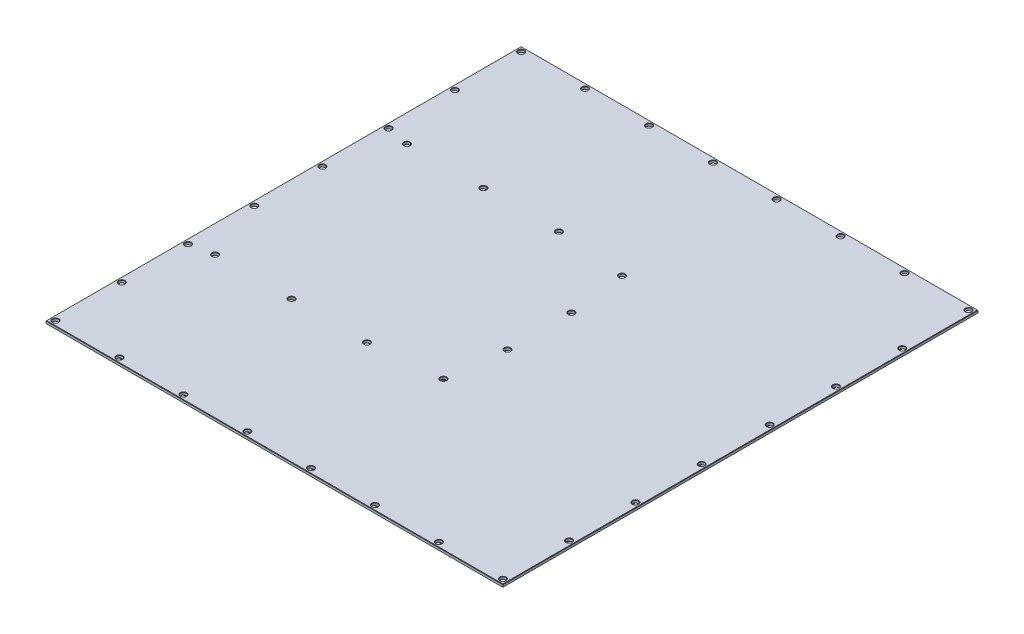
from build123d import *

# Parameters (mm, degrees)
SKETCH1_W          = 317.5
SKETCH1_H          = 330.2
SKETCH1_R          = 1.9812
EXTRUDE4_DEPTH     = 3.175
SKETCH4_R          = 1.9812
NEW_HOLES_DEPTH    = 459.092098409
SKETCH12_W         = 365.029179117
SKETCH12_H         = 387.810687419
CUT_EXTRUDE4_DEPTH = 441.120212015
CUT_EXTRUDE5_DEPTH = 439.693255009
CUT_EXTRUDE5_DRAFT = 15
CUT_EXTRUDE6_DEPTH = 437.337185337
CUT_EXTRUDE6_DRAFT = 15
CUT_EXTRUDE7_DEPTH = 459.084701019
CHAMFER1_SIZE      = 0.254


with BuildPart() as part:
    # Sketch1 → Extrude4 (new body)
    with BuildSketch(Plane(origin=(0, 0, 0), x_dir=(1, 0, 0), z_dir=(0, 1, 0))):
        with Locations((158.75, 165.1)):
            Rectangle(SKETCH1_W, SKETCH1_H)
        with Locations(Location((3.302, 326.898, 0), (0, 0, 270))):
            Circle(SKETCH1_R, mode=Mode.SUBTRACT)
        with Locations(Location((3.302, 141.4526, 0), (0, 0, 90))):
            Circle(SKETCH1_R, mode=Mode.SUBTRACT)
        with Locations(Location((47.752, 326.898, 0), (0, 0, 270))):
            Circle(SKETCH1_R, mode=Mode.SUBTRACT)
        with Locations(Location((92.202, 326.898, 0), (0, 0, 270))):
            Circle(SKETCH1_R, mode=Mode.SUBTRACT)
        with Locations(Location((136.652, 326.898, 0), (0, 0, 270))):
            Circle(SKETCH1_R, mode=Mode.SUBTRACT)
        with Locations(Location((3.302, 280.8478, 0), (0, 0, 270))):
            Circle(SKETCH1_R, mode=Mode.SUBTRACT)
        with Locations(Location((3.302, 234.7976, 0), (0, 0, 270))):
            Circle(SKETCH1_R, mode=Mode.SUBTRACT)
        with Locations(Location((3.302, 188.7474, 0), (0, 0, 270))):
            Circle(SKETCH1_R, mode=Mode.SUBTRACT)
        with Locations(Location((3.302, 95.4024, 0), (0, 0, 90))):
            Circle(SKETCH1_R, mode=Mode.SUBTRACT)
        with Locations(Location((3.302, 49.3522, 0), (0, 0, 90))):
            Circle(SKETCH1_R, mode=Mode.SUBTRACT)
        with Locations(Location((136.652, 3.302, 0), (0, 0, 90))):
            Circle(SKETCH1_R, mode=Mode.SUBTRACT)
        with Locations(Location((92.202, 3.302, 0), (0, 0, 90))):
            Circle(SKETCH1_R, mode=Mode.SUBTRACT)
        with Locations(Location((47.752, 3.302, 0), (0, 0, 90))):
            Circle(SKETCH1_R, mode=Mode.SUBTRACT)
        with Locations(Location((3.302, 3.302, 0), (0, 0, 90))):
            Circle(SKETCH1_R, mode=Mode.SUBTRACT)
        with Locations(Location((314.198, 3.302, 0), (0, 0, 270))):
            Circle(SKETCH1_R, mode=Mode.SUBTRACT)
        with Locations(Location((269.748, 3.302, 0), (0, 0, 270))):
            Circle(SKETCH1_R, mode=Mode.SUBTRACT)
        with Locations(Location((225.298, 3.302, 0), (0, 0, 270))):
            Circle(SKETCH1_R, mode=Mode.SUBTRACT)
        with Locations(Location((180.848, 3.302, 0), (0, 0, 270))):
            Circle(SKETCH1_R, mode=Mode.SUBTRACT)
        with Locations(Location((314.198, 49.3522, 0), (0, 0, 270))):
            Circle(SKETCH1_R, mode=Mode.SUBTRACT)
        with Locations(Location((314.198, 95.4024, 0), (0, 0, 270))):
            Circle(SKETCH1_R, mode=Mode.SUBTRACT)
        with Locations(Location((314.198, 188.7474, 0), (0, 0, 90))):
            Circle(SKETCH1_R, mode=Mode.SUBTRACT)
        with Locations(Location((314.198, 234.7976, 0), (0, 0, 90))):
            Circle(SKETCH1_R, mode=Mode.SUBTRACT)
        with Locations(Location((314.198, 280.8478, 0), (0, 0, 90))):
            Circle(SKETCH1_R, mode=Mode.SUBTRACT)
        with Locations(Location((180.848, 326.898, 0), (0, 0, 90))):
            Circle(SKETCH1_R, mode=Mode.SUBTRACT)
        with Locations(Location((225.298, 326.898, 0), (0, 0, 90))):
            Circle(SKETCH1_R, mode=Mode.SUBTRACT)
        with Locations(Location((269.748, 326.898, 0), (0, 0, 90))):
            Circle(SKETCH1_R, mode=Mode.SUBTRACT)
        with Locations(Location((314.198, 141.4526, 0), (0, 0, 270))):
            Circle(SKETCH1_R, mode=Mode.SUBTRACT)
        with Locations(Location((314.198, 326.898, 0), (0, 0, 90))):
            Circle(SKETCH1_R, mode=Mode.SUBTRACT)
        with Locations(Location((19.05, 231.775, 0), (0, 0, 270))):
            Circle(SKETCH1_R, mode=Mode.SUBTRACT)
        with Locations(Location((72.2122, 231.775, 0), (0, 0, 270))):
            Circle(SKETCH1_R, mode=Mode.SUBTRACT)
        with Locations(Location((124.6378, 231.775, 0), (0, 0, 270))):
            Circle(SKETCH1_R, mode=Mode.SUBTRACT)
        with Locations(Location((124.6378, 98.425, 0), (0, 0, 90))):
            Circle(SKETCH1_R, mode=Mode.SUBTRACT)
        with Locations(Location((72.2122, 98.425, 0), (0, 0, 90))):
            Circle(SKETCH1_R, mode=Mode.SUBTRACT)
        with Locations(Location((19.05, 98.425, 0), (0, 0, 90))):
            Circle(SKETCH1_R, mode=Mode.SUBTRACT)
        with Locations(Location((177.8, 187.325, 0), (0, 0, 270))):
            Circle(SKETCH1_R, mode=Mode.SUBTRACT)
        with Locations(Location((177.8, 142.875, 0), (0, 0, 90))):
            Circle(SKETCH1_R, mode=Mode.SUBTRACT)
    extrude(amount=EXTRUDE4_DEPTH)

    # Sketch4 → new holes (cut, through all)
    with BuildSketch(Plane.XZ):
        with Locations(Location((173.150320151, -227.125320151, 0), (0, 0, 270))):
            Circle(SKETCH4_R)
        with Locations(Location((173.150320151, -103.074679849, 0), (0, 0, 270))):
            Circle(SKETCH4_R)
    extrude(amount=-NEW_HOLES_DEPTH, mode=Mode.SUBTRACT)

    # Sketch12 → Cut-Extrude4 (cut, through all)
    with BuildSketch(Plane(origin=(3.089378177, 1.397, -22.225), x_dir=(1, 0, 0), z_dir=(0, -1, 0))):
        with Locations((152.779774702, -139.492814523)):
            Rectangle(SKETCH12_W, SKETCH12_H)
        with BuildLine():
            Line((2.617480918, 0), (2.617480918, -285.75))
            ThreePointArc((2.617480918, -285.75), (7.455532376, -297.430089447), (19.135621823, -302.268140905))
            Line((19.135621823, -302.268140905), (292.175461823, -302.268140905))
            ThreePointArc((292.175461823, -302.268140905), (303.855551269, -297.430089447), (308.693602728, -285.75))
            Line((308.693602728, -285.75), (308.693602728, 0))
            ThreePointArc((308.693602728, 0), (303.855551269, 11.680089447), (292.175461823, 16.518140905))
            Line((292.175461823, 16.518140905), (19.135621823, 16.518140905))
            ThreePointArc((19.135621823, 16.518140905), (7.455532376, 11.680089447), (2.617480918, 0))
        make_face(mode=Mode.SUBTRACT)
    extrude(amount=CUT_EXTRUDE4_DEPTH, mode=Mode.SUBTRACT)


with BuildPart() as cut_extrude5_tool:
    # Sketch14 → Cut-Extrude5 (with draft: the straight prism first)
    with BuildSketch(Plane(origin=(5.090745431, 1.27, -22.225), x_dir=(-1, 0, 0), z_dir=(0, 1, 0))):
        with BuildLine():
            Line((0.5715, -285.75), (0.5715, 0))
            ThreePointArc((0.5715, 0), (-4.614395447, 12.519859122), (-17.134254569, 17.705754569))
            Line((-17.134254569, 17.705754569), (-290.174094569, 17.705754569))
            ThreePointArc((-290.174094569, 17.705754569), (-302.693953691, 12.519859122), (-307.879849139, 0))
            Line((-307.879849139, 0), (-307.879849139, -285.75))
            ThreePointArc((-307.879849139, -285.75), (-302.693953691, -298.269859122), (-290.174094569, -303.455754569))
            Line((-290.174094569, -303.455754569), (-17.134254569, -303.455754569))
            ThreePointArc((-17.134254569, -303.455754569), (-4.614395447, -298.269859122), (0.5715, -285.75))
        make_face()
        with BuildLine():
            Line((-0.5715, -285.75), (-0.5715, 0))
            ThreePointArc((-0.5715, 0), (-5.422618498, 11.711636071), (-17.134254569, 16.562754569))
            Line((-17.134254569, 16.562754569), (-290.174094569, 16.562754569))
            ThreePointArc((-290.174094569, 16.562754569), (-301.88573064, 11.711636071), (-306.736849139, 0))
            Line((-306.736849139, 0), (-306.736849139, -285.75))
            ThreePointArc((-306.736849139, -285.75), (-301.88573064, -297.461636071), (-290.174094569, -302.312754569))
            Line((-290.174094569, -302.312754569), (-17.134254569, -302.312754569))
            ThreePointArc((-17.134254569, -302.312754569), (-5.422618498, -297.461636071), (-0.5715, -285.75))
        make_face(mode=Mode.SUBTRACT)
    extrude(amount=-CUT_EXTRUDE5_DEPTH)
    # Cut-Extrude5: the draft: its side faces are tilted about the plane it starts from
    cut_extrude5_sides = [cut_extrude5_tool.faces().sort_by_distance(p)[0] for p in [
        (4.519245431, -218.576627505, -165.1),
        (9.705140878, -218.576627505, -9.705140878),
        (158.74492, -218.576627505, -4.519245431),
        (307.784699122, -218.576627505, -9.705140878),
        (312.970594569, -218.576627505, -165.1),
        (307.784699122, -218.576627505, -320.494859122),
        (158.74492, -218.576627505, -325.680754569),
        (9.705140878, -218.576627505, -320.494859122),
        (10.513363929, -218.576627505, -319.686636071),
        (158.74492, -218.576627505, -324.537754569),
        (306.976476071, -218.576627505, -319.686636071),
        (311.827594569, -218.576627505, -165.1),
        (306.976476071, -218.576627505, -10.513363929),
        (158.74492, -218.576627505, -5.662245431),
        (10.513363929, -218.576627505, -10.513363929),
        (5.662245431, -218.576627505, -165.1),
    ]]
    draft(cut_extrude5_sides, Plane(origin=(5.090745431, 1.27, -22.225), x_dir=(-1, 0, 0), z_dir=(0, 1, 0)), CUT_EXTRUDE5_DRAFT)


with BuildPart() as part_1:
    add(part.part)

    # Cut-Extrude5: cut by cut_extrude5_tool
    add(cut_extrude5_tool.part, mode=Mode.SUBTRACT)


with BuildPart() as cut_extrude6_tool:
    # Sketch15 → Cut-Extrude6 (with draft: the straight prism first)
    with BuildSketch(Plane(origin=(8.4074, 1.357499539, -22.225), x_dir=(-1, 0, 0), z_dir=(0, 1, 0))):
        with BuildLine():
            Line((0.635, -285.75), (0.635, 0))
            ThreePointArc((0.635, 0), (-3.598068534, 10.219531466), (-13.8176, 14.4526))
            Line((-13.8176, 14.4526), (-286.85744, 14.4526))
            ThreePointArc((-286.85744, 14.4526), (-297.076971466, 10.219531466), (-301.31004, 0))
            Line((-301.31004, 0), (-301.31004, -285.75))
            ThreePointArc((-301.31004, -285.75), (-297.076971466, -295.969531466), (-286.85744, -300.2026))
            Line((-286.85744, -300.2026), (-13.8176, -300.2026))
            ThreePointArc((-13.8176, -300.2026), (-3.598068534, -295.969531466), (0.635, -285.75))
        make_face()
        with BuildLine():
            Line((-13.8176, -78.88986), (-153.5176, -78.88986))
            ThreePointArc((-153.5176, -78.88986), (-162.840901905, -82.751698095), (-166.70274, -92.075))
            Line((-166.70274, -92.075), (-166.70274, -193.675))
            ThreePointArc((-166.70274, -193.675), (-162.840901905, -202.998301905), (-153.5176, -206.86014))
            Line((-153.5176, -206.86014), (-13.8176, -206.86014))
            ThreePointArc((-13.8176, -206.86014), (-4.494298095, -202.998301905), (-0.63246, -193.675))
            Line((-0.63246, -193.675), (-0.63246, -92.075))
            ThreePointArc((-0.63246, -92.075), (-4.494298095, -82.751698095), (-13.8176, -78.88986))
        make_face(mode=Mode.SUBTRACT)
        with BuildLine():
            Line((-13.8176, -212.23986), (-153.5176, -212.23986))
            ThreePointArc((-153.5176, -212.23986), (-166.644938398, -206.802338398), (-172.08246, -193.675))
            Line((-172.08246, -193.675), (-172.08246, -92.075))
            ThreePointArc((-172.08246, -92.075), (-166.644938398, -78.947661602), (-153.5176, -73.51014))
            Line((-153.5176, -73.51014), (-13.8176, -73.51014))
            ThreePointArc((-13.8176, -73.51014), (-4.494298095, -69.648301905), (-0.63246, -60.325))
            Line((-0.63246, -60.325), (-0.63246, 0))
            ThreePointArc((-0.63246, 0), (-4.494298095, 9.323301905), (-13.8176, 13.18514))
            Line((-13.8176, 13.18514), (-286.85744, 13.18514))
            ThreePointArc((-286.85744, 13.18514), (-296.180741905, 9.323301905), (-300.04258, 0))
            Line((-300.04258, 0), (-300.04258, -285.75))
            ThreePointArc((-300.04258, -285.75), (-296.180741905, -295.073301905), (-286.85744, -298.93514))
            Line((-286.85744, -298.93514), (-13.8176, -298.93514))
            ThreePointArc((-13.8176, -298.93514), (-4.494298095, -295.073301905), (-0.63246, -285.75))
            Line((-0.63246, -285.75), (-0.63246, -225.425))
            ThreePointArc((-0.63246, -225.425), (-4.494298095, -216.101698095), (-13.8176, -212.23986))
        make_face(mode=Mode.SUBTRACT)
    extrude(amount=-CUT_EXTRUDE6_DEPTH)
    # Cut-Extrude6: the draft: its side faces are tilted about the plane it starts from
    cut_extrude6_sides = [cut_extrude6_tool.faces().sort_by_distance(p)[0] for p in [
        (7.7724, -217.31109313, -165.1),
        (12.005468534, -217.31109313, -12.005468534),
        (158.74492, -217.31109313, -7.7724),
        (305.484371466, -217.31109313, -12.005468534),
        (309.71744, -217.31109313, -165.1),
        (305.484371466, -217.31109313, -318.194531466),
        (158.74492, -217.31109313, -322.4276),
        (12.005468534, -217.31109313, -318.194531466),
        (12.901698095, -217.31109313, -225.223301905),
        (92.075, -217.31109313, -229.08514),
        (171.248301905, -217.31109313, -225.223301905),
        (175.11014, -217.31109313, -165.1),
        (171.248301905, -217.31109313, -104.976698095),
        (92.075, -217.31109313, -101.11486),
        (12.901698095, -217.31109313, -104.976698095),
        (9.03986, -217.31109313, -165.1),
        (158.74492, -217.31109313, -9.03986),
        (12.901698095, -217.31109313, -12.901698095),
        (9.03986, -217.31109313, -52.3875),
        (12.901698095, -217.31109313, -91.873301905),
        (92.075, -217.31109313, -95.73514),
        (175.052338398, -217.31109313, -101.172661602),
        (180.48986, -217.31109313, -165.1),
        (175.052338398, -217.31109313, -229.027338398),
        (92.075, -217.31109313, -234.46486),
        (12.901698095, -217.31109313, -238.326698095),
        (9.03986, -217.31109313, -277.8125),
        (12.901698095, -217.31109313, -317.298301905),
        (158.74492, -217.31109313, -321.16014),
        (304.588141905, -217.31109313, -317.298301905),
        (308.44998, -217.31109313, -165.1),
        (304.588141905, -217.31109313, -12.901698095),
    ]]
    draft(cut_extrude6_sides, Plane(origin=(8.4074, 1.357499539, -22.225), x_dir=(-1, 0, 0), z_dir=(0, 1, 0)), CUT_EXTRUDE6_DRAFT)


with BuildPart() as part_2:
    add(part_1.part)

    # Cut-Extrude6: cut by cut_extrude6_tool
    add(cut_extrude6_tool.part, mode=Mode.SUBTRACT)

    # Sketch18 → Cut-Extrude7 (cut, through all)
    with BuildSketch(Plane.XZ.offset(-1.357499539)):
        with BuildLine():
            Line((80.0735, -216.9668), (116.7765, -216.9668))
            ThreePointArc((116.7765, -216.9668), (118.033735857, -217.487564143), (118.5545, -218.7448))
            Line((118.5545, -218.7448), (118.5545, -244.8052))
            ThreePointArc((118.5545, -244.8052), (118.033735857, -246.062435857), (116.7765, -246.5832))
            Line((116.7765, -246.5832), (80.0735, -246.5832))
            ThreePointArc((80.0735, -246.5832), (78.816264143, -246.062435857), (78.2955, -244.8052))
            Line((78.2955, -244.8052), (78.2955, -218.7448))
            ThreePointArc((78.2955, -218.7448), (78.816264143, -217.487564143), (80.0735, -216.9668))
        make_face()
        with BuildLine():
            Line((78.2955, -111.4552), (78.2955, -85.3948))
            ThreePointArc((78.2955, -85.3948), (78.816264143, -84.137564143), (80.0735, -83.6168))
            Line((80.0735, -83.6168), (116.7765, -83.6168))
            ThreePointArc((116.7765, -83.6168), (118.033735857, -84.137564143), (118.5545, -85.3948))
            Line((118.5545, -85.3948), (118.5545, -111.4552))
            ThreePointArc((118.5545, -111.4552), (118.033735857, -112.712435857), (116.7765, -113.2332))
            Line((116.7765, -113.2332), (80.0735, -113.2332))
            ThreePointArc((80.0735, -113.2332), (78.816264143, -112.712435857), (78.2955, -111.4552))
        make_face()
    extrude(amount=CUT_EXTRUDE7_DEPTH, mode=Mode.SUBTRACT)

    # Chamfer1
    chamfer1_edges = [part_2.edges().sort_by_distance(p)[0] for p in [
        (317.5, 3.175, -165.1),
        (225.298, 3.175, -324.9168),
        (269.748, 3.175, -324.9168),
        (314.198, 3.175, -143.4338),
        (314.198, 3.175, -324.9168),
        (19.05, 3.175, -233.7562),
        (3.302, 3.175, -328.8792),
        (72.2122, 3.175, -233.7562),
        (124.6378, 3.175, -233.7562),
        (124.6378, 3.175, -96.4438),
        (158.75, 3.175, -330.2),
        (72.2122, 3.175, -96.4438),
        (19.05, 3.175, -96.4438),
        (177.8, 3.175, -189.3062),
        (177.8, 3.175, -140.8938),
        (47.752, 3.175, -328.8792),
        (92.202, 3.175, -328.8792),
        (173.150320151, 3.175, -225.144120151),
        (173.150320151, 3.175, -101.093479849),
        (136.652, 3.175, -328.8792),
        (3.302, 3.175, -139.4714),
        (3.302, 3.175, -282.829),
        (3.302, 3.175, -236.7788),
        (3.302, 3.175, -190.7286),
        (0, 3.175, -165.1),
        (3.302, 3.175, -93.4212),
        (3.302, 3.175, -47.371),
        (136.652, 3.175, -1.3208),
        (92.202, 3.175, -1.3208),
        (47.752, 3.175, -1.3208),
        (3.302, 3.175, -1.3208),
        (314.198, 3.175, -5.2832),
        (269.748, 3.175, -5.2832),
        (158.75, 3.175, 0),
        (225.298, 3.175, -5.2832),
        (180.848, 3.175, -5.2832),
        (314.198, 3.175, -51.3334),
        (314.198, 3.175, -97.3836),
        (314.198, 3.175, -186.7662),
        (314.198, 3.175, -232.8164),
        (314.198, 3.175, -278.8666),
        (180.848, 3.175, -324.9168),
    ]]
    chamfer(chamfer1_edges, length=CHAMFER1_SIZE)


solid = part_2.part
